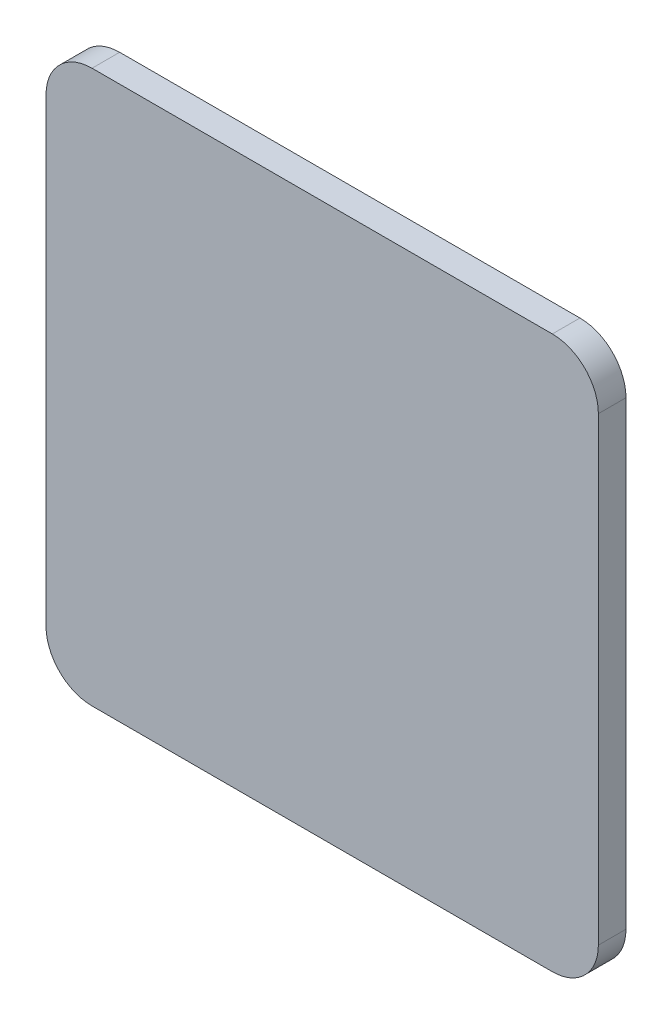
from build123d import *

# Parameters (mm, degrees)
SKETCH_2_W      = 60
SKETCH_2_H      = 60
EXTRUDE_1_DEPTH = 1.5
FILLET_1_R      = 5


with BuildPart() as part:
    # Эскиз2 → Бобышка-Вытянуть1 (new, symmetric)
    with BuildSketch(Plane.XY):
        Rectangle(SKETCH_2_W, SKETCH_2_H)
    extrude(amount=EXTRUDE_1_DEPTH, both=True)

    # Скругление1
    fillet_1_edges = [part.edges().sort_by_distance(p)[0] for p in [
        (30, -30, 0),
        (-30, -30, 0),
        (-30, 30, 0),
        (30, 30, 0),
    ]]
    fillet(fillet_1_edges, radius=FILLET_1_R)


solid = part.part
